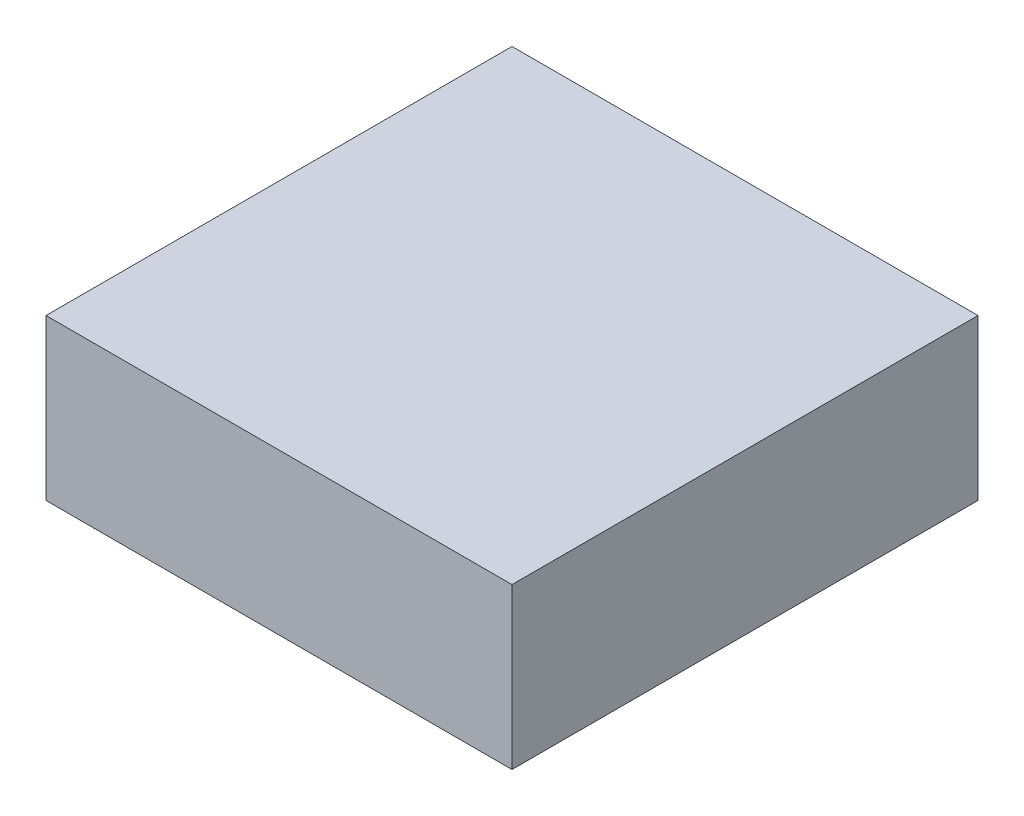
from build123d import *

# Parameters (mm, degrees)
SKETCH1_W           = 64
SKETCH1_H           = 64
BOSS_EXTRUDE1_DEPTH = 22


with BuildPart() as part:
    # Sketch1 → Boss-Extrude1 (new body)
    with BuildSketch(Plane(origin=(0, 0, 0), x_dir=(1, 0, 0), z_dir=(0, 1, 0))):
        Rectangle(SKETCH1_W, SKETCH1_H)
    extrude(amount=BOSS_EXTRUDE1_DEPTH)


solid = part.part
